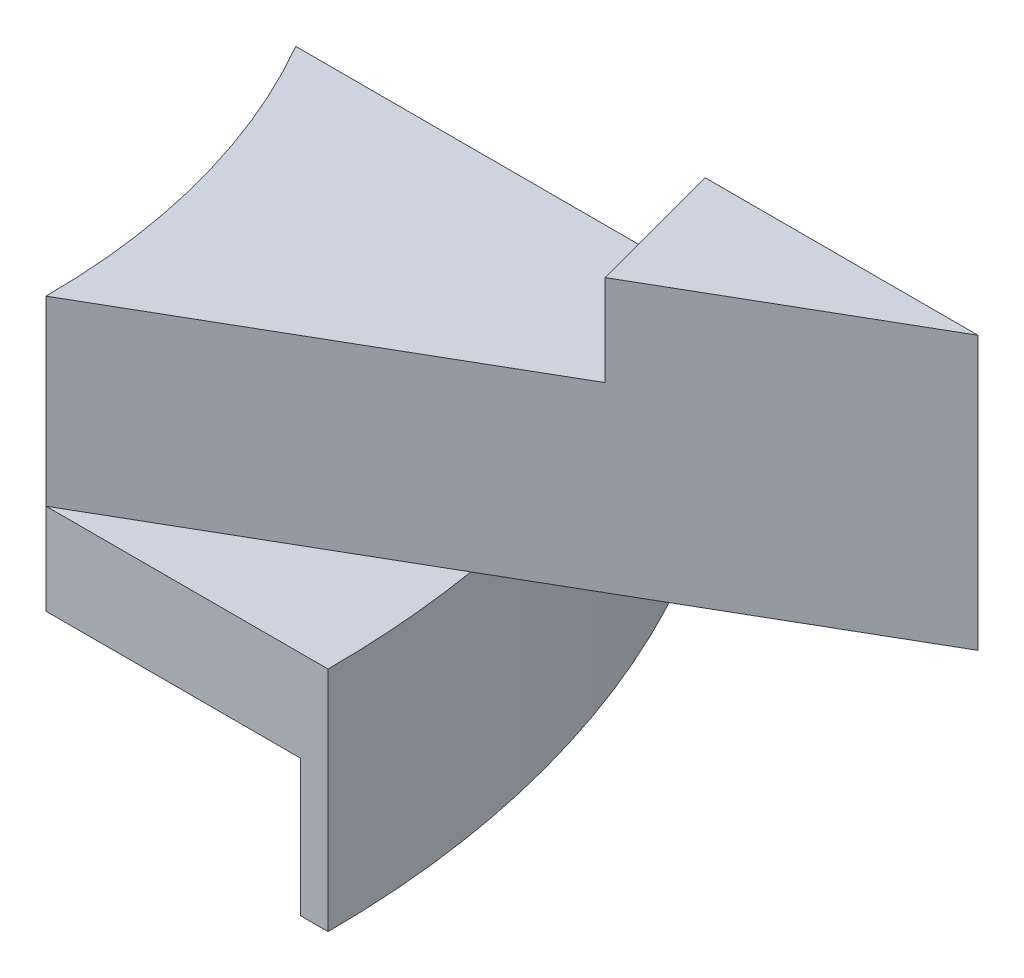
from build123d import *

# Parameters (mm, degrees)
EXTRUDE_3_DEPTH = 10
EXTRUDE_4_DEPTH = 20
EXTRUDE_5_DEPTH = 10
EXTRUDE_START   = 25
EXTRUDE_6_DEPTH = 25


with BuildPart() as part:
    # 草图1 → 凸台-拉伸3 (new body)
    with BuildSketch(Plane(origin=(0, 0, 0), x_dir=(1, 0, 0), z_dir=(0, 1, 0))):
        with BuildLine():
            Line((64.951905284, 37.5), (89.20061659, 51.5))
            ThreePointArc((89.20061659, 51.5), (99.490360108, 26.658361646), (103, 0))
            Line((103, 0), (75, 0))
            ThreePointArc((75, 0), (72.444436972, 19.411428383), (64.951905284, 37.5))
        make_face()
    extrude(amount=EXTRUDE_3_DEPTH)

    # 草图5 → 凸台-拉伸4 (add)
    with BuildSketch(Plane(origin=(0, 10, 0), x_dir=(1, 0, 0), z_dir=(0, 1, 0))):
        with BuildLine():
            Line((64.951905284, 37.5), (139.951905284, 37.5))
            Line((139.951905284, 37.5), (75, 0))
            ThreePointArc((75, 0), (72.444436972, 19.411428383), (64.951905284, 37.5))
        make_face()
    extrude(amount=EXTRUDE_4_DEPTH)

    # 草图6 → 凸台-拉伸5 (add)
    with BuildSketch(Plane(origin=(0, 30, 0), x_dir=(1, 0, 0), z_dir=(0, 1, 0))):
        Polygon((109.951905284, 37.5), (139.951905284, 37.5), (113.97114317, 22.5), align=None)
    extrude(amount=EXTRUDE_5_DEPTH)

    # 草图7 → 凸台-拉伸6 (add)
    with BuildSketch(Plane.XZ.offset(-10).offset(EXTRUDE_START)):
        with BuildLine():
            Line((89.20061659, -51.5), (91.798692801, -53))
            ThreePointArc((91.798692801, -53), (102.388137587, -27.434818781), (106, 0))
            Line((106, 0), (103, 0))
            ThreePointArc((103, 0), (99.490360108, -26.658361646), (89.20061659, -51.5))
        make_face()
    extrude(amount=-EXTRUDE_6_DEPTH)


solid = part.part
